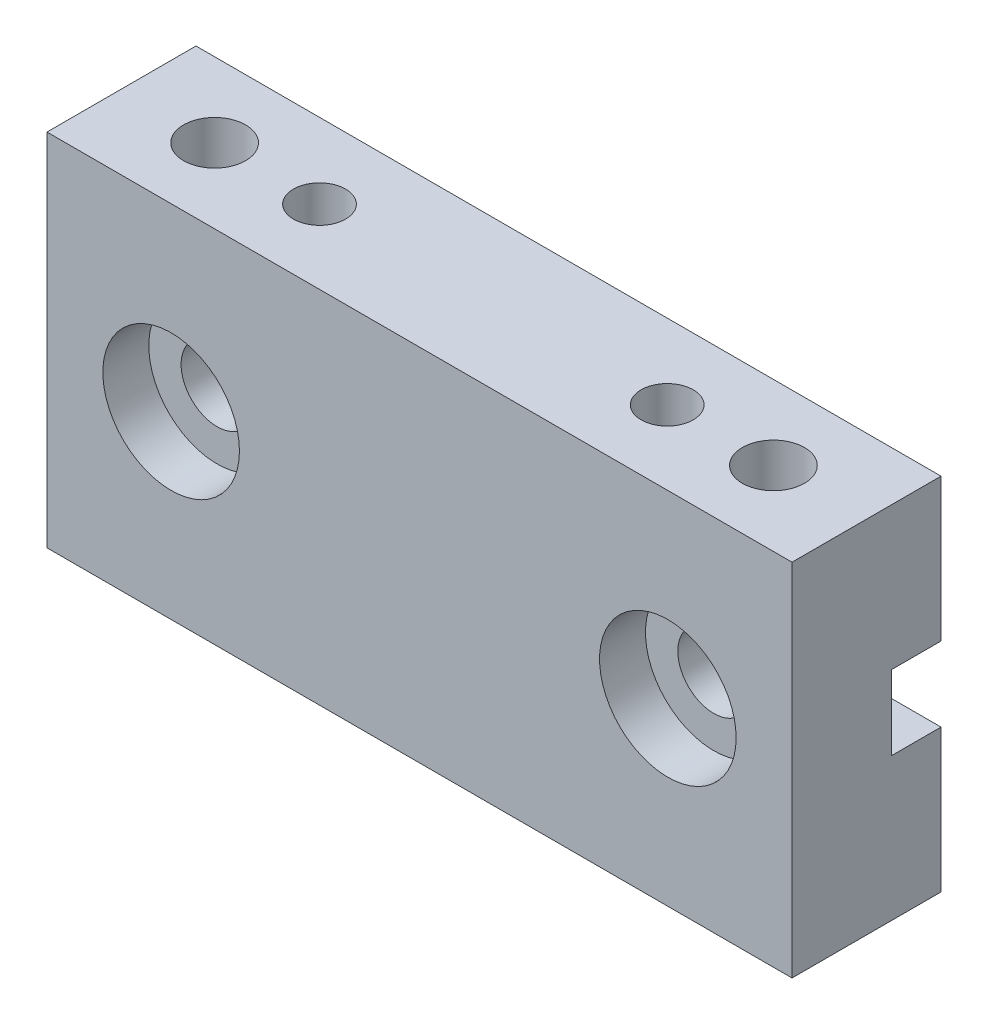
from build123d import *

# Parameters (mm, degrees)
SKETCH1_W                                = 60
SKETCH1_H                                = 12
BOSS_EXTRUDE1_DEPTH                      = 11.5
SKETCH4_W                                = 60
SKETCH4_H                                = 8
BOSS_EXTRUDE2_DEPTH                      = 17.5
SKETCH9_W                                = 12
SKETCH9_H                                = 11.5
BOSS_EXTRUDE3_DEPTH                      = 60
CBORE_FOR_M5_PAN_HEAD_SCREW2_D           = 5.8
CBORE_FOR_M5_PAN_HEAD_SCREW2_DEPTH       = 8.2
CBORE_FOR_M5_PAN_HEAD_SCREW2_CBORE_D     = 11
CBORE_FOR_M5_PAN_HEAD_SCREW2_CBORE_DEPTH = 3.7
CBORE_FOR_M5_PAN_HEAD_SCREW2_TIP         = 1.742495795
F_5_0MM_DOWEL_HOLE7_D                    = 5
F_5_0MM_DOWEL_HOLE7_DEPTH                = 9
F_5_0MM_DOWEL_HOLE7_TIP                  = 1.502151548
F_5_0MM_DOWEL_HOLE8_D                    = 5
F_5_0MM_DOWEL_HOLE8_DEPTH                = 9
F_5_0MM_DOWEL_HOLE8_TIP                  = 1.502151548
M5_TAPPED_HOLE2_D                        = 4.2
M5_TAPPED_HOLE2_DEPTH                    = 12.4
M5_TAPPED_HOLE2_TIP                      = 1.2618073
M5_TAPPED_HOLE3_D                        = 4.2
M5_TAPPED_HOLE3_DEPTH                    = 12.4
M5_TAPPED_HOLE3_TIP                      = 1.2618073


with BuildPart() as part:
    # Sketch1 → Boss-Extrude1 (new body)
    with BuildSketch(Plane(origin=(0, 0, 0), x_dir=(1, 0, 0), z_dir=(0, 1, 0))):
        with Locations((30, 6)):
            Rectangle(SKETCH1_W, SKETCH1_H)
    extrude(amount=BOSS_EXTRUDE1_DEPTH)

    # Sketch4 → Boss-Extrude2 (add)
    with BuildSketch(Plane(origin=(0, 0, 0), x_dir=(1, 0, 0), z_dir=(0, 1, 0))):
        with Locations((30, 4)):
            Rectangle(SKETCH4_W, SKETCH4_H)
    extrude(amount=BOSS_EXTRUDE2_DEPTH)

    # Sketch9 → Boss-Extrude3 (add)
    with BuildSketch(Plane(origin=(0, 0, 0), x_dir=(0, 0, -1), z_dir=(1, 0, 0))):
        with Locations((6, 23.25)):
            Rectangle(SKETCH9_W, SKETCH9_H)
    extrude(amount=BOSS_EXTRUDE3_DEPTH)

    # CBORE for M5 Pan Head Screw2
    with Locations(Plane.XY):
        with Locations((50, 14.5), (10, 14.5)):
            CounterBoreHole(CBORE_FOR_M5_PAN_HEAD_SCREW2_D / 2, CBORE_FOR_M5_PAN_HEAD_SCREW2_CBORE_D / 2, CBORE_FOR_M5_PAN_HEAD_SCREW2_CBORE_DEPTH, depth=CBORE_FOR_M5_PAN_HEAD_SCREW2_DEPTH)
            with Locations((0, 0, -(CBORE_FOR_M5_PAN_HEAD_SCREW2_DEPTH + CBORE_FOR_M5_PAN_HEAD_SCREW2_TIP / 2))):  # 118° drill point
                Cone(0, CBORE_FOR_M5_PAN_HEAD_SCREW2_D / 2, CBORE_FOR_M5_PAN_HEAD_SCREW2_TIP, mode=Mode.SUBTRACT)

    # Ø5.0mm Dowel Hole7
    with Locations(Plane(origin=(0, 29, 0), x_dir=(1, 0, 0), z_dir=(0, 1, 0))):
        with Locations((7.5, 6)):
            Hole(F_5_0MM_DOWEL_HOLE7_D / 2, depth=F_5_0MM_DOWEL_HOLE7_DEPTH)
            with Locations((0, 0, -(F_5_0MM_DOWEL_HOLE7_DEPTH + F_5_0MM_DOWEL_HOLE7_TIP / 2))):  # 118° drill point
                Cone(0, F_5_0MM_DOWEL_HOLE7_D / 2, F_5_0MM_DOWEL_HOLE7_TIP, mode=Mode.SUBTRACT)

    # Ø5.0mm Dowel Hole8
    with Locations(Plane(origin=(0, 29, 0), x_dir=(1, 0, 0), z_dir=(0, 1, 0))):
        with Locations((52.5, 6)):
            Hole(F_5_0MM_DOWEL_HOLE8_D / 2, depth=F_5_0MM_DOWEL_HOLE8_DEPTH)
            with Locations((0, 0, -(F_5_0MM_DOWEL_HOLE8_DEPTH + F_5_0MM_DOWEL_HOLE8_TIP / 2))):  # 118° drill point
                Cone(0, F_5_0MM_DOWEL_HOLE8_D / 2, F_5_0MM_DOWEL_HOLE8_TIP, mode=Mode.SUBTRACT)

    # M5 Tapped Hole2
    with Locations(Plane(origin=(0, 29, 0), x_dir=(1, 0, 0), z_dir=(0, 1, 0))):
        with Locations((16, 5.948108633)):
            Hole(M5_TAPPED_HOLE2_D / 2, depth=M5_TAPPED_HOLE2_DEPTH)
            with Locations((0, 0, -(M5_TAPPED_HOLE2_DEPTH + M5_TAPPED_HOLE2_TIP / 2))):  # 118° drill point
                Cone(0, M5_TAPPED_HOLE2_D / 2, M5_TAPPED_HOLE2_TIP, mode=Mode.SUBTRACT)

    # M5 Tapped Hole3
    with Locations(Plane(origin=(0, 29, 0), x_dir=(1, 0, 0), z_dir=(0, 1, 0))):
        with Locations((44, 5.948108633)):
            Hole(M5_TAPPED_HOLE3_D / 2, depth=M5_TAPPED_HOLE3_DEPTH)
            with Locations((0, 0, -(M5_TAPPED_HOLE3_DEPTH + M5_TAPPED_HOLE3_TIP / 2))):  # 118° drill point
                Cone(0, M5_TAPPED_HOLE3_D / 2, M5_TAPPED_HOLE3_TIP, mode=Mode.SUBTRACT)


solid = part.part
